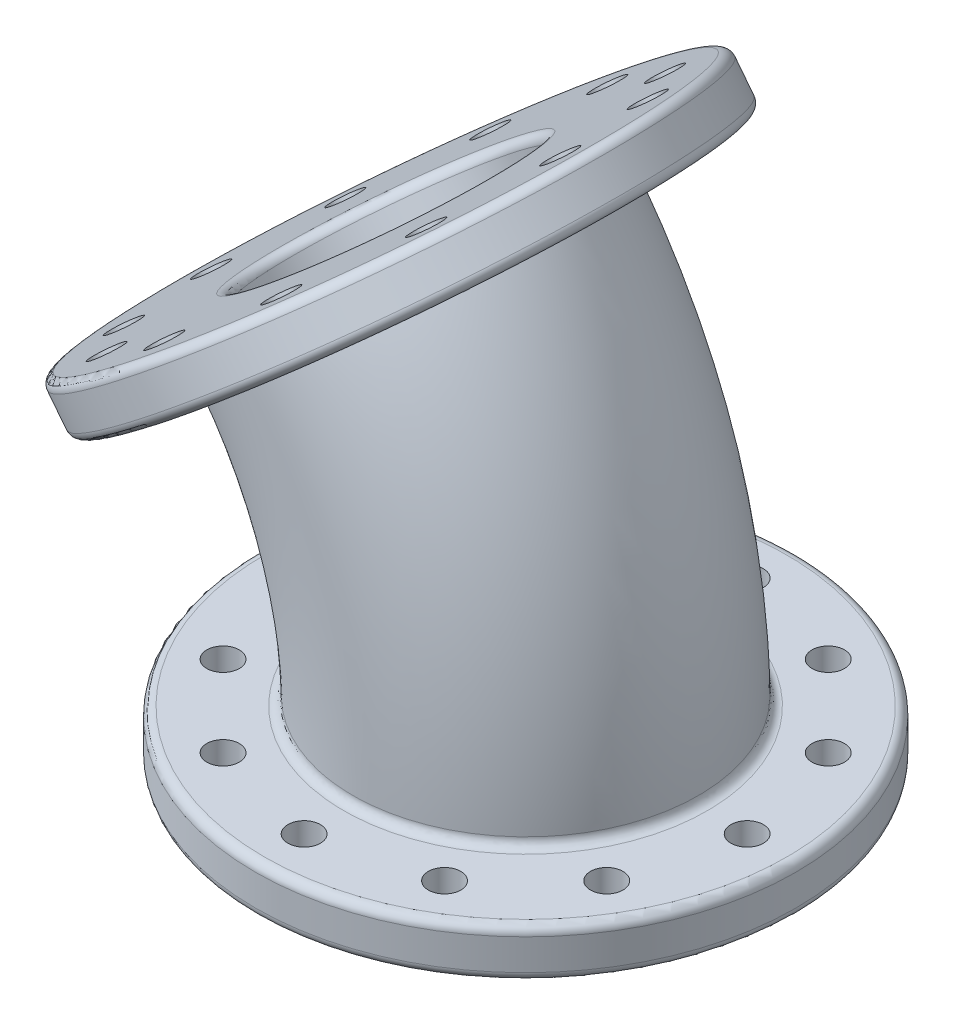
from build123d import *

# Parameters (mm, degrees)
SKETCH1_R           = 61
SKETCH1_R_2         = 3.665
SKETCH1_R_3         = 28
BOSS_EXTRUDE1_DEPTH = 11
SKETCH4_R           = 39
SKETCH4_R_2         = 28
REVOLVE3_ANGLE      = 38
FILLET2_R           = 2
SKETCH6_R           = 61
SKETCH6_R_2         = 28
SKETCH6_R_3         = 3.665
BOSS_EXTRUDE4_DEPTH = 11
FILLET3_R           = 2


with BuildPart() as part:
    # Sketch1 → Boss-Extrude1 (new body)
    with BuildSketch(Plane(origin=(0, 0, 0), x_dir=(1, 0, 0), z_dir=(0, 1, 0))):
        with Locations(Location((0, 0, 0), (0, 0, 270))):
            Circle(SKETCH1_R)
        with Locations(Location((0, 50, 0), (0, 0, 270))):
            Circle(SKETCH1_R_2, mode=Mode.SUBTRACT)
        with Locations(Location((0, 0, 0), (0, 0, 270))):
            Circle(SKETCH1_R_3, mode=Mode.SUBTRACT)
        with Locations(Location((25, 43.301270189, 0), (0, 0, 270))):
            Circle(SKETCH1_R_2, mode=Mode.SUBTRACT)
        with Locations(Location((43.301270189, 25, 0), (0, 0, 270))):
            Circle(SKETCH1_R_2, mode=Mode.SUBTRACT)
        with Locations(Location((50, 0, 0), (0, 0, 270))):
            Circle(SKETCH1_R_2, mode=Mode.SUBTRACT)
        with Locations(Location((43.301270189, -25, 0), (0, 0, 270))):
            Circle(SKETCH1_R_2, mode=Mode.SUBTRACT)
        with Locations(Location((25, -43.301270189, 0), (0, 0, 270))):
            Circle(SKETCH1_R_2, mode=Mode.SUBTRACT)
        with Locations(Location((0, -50, 0), (0, 0, 270))):
            Circle(SKETCH1_R_2, mode=Mode.SUBTRACT)
        with Locations(Location((-25, -43.301270189, 0), (0, 0, 270))):
            Circle(SKETCH1_R_2, mode=Mode.SUBTRACT)
        with Locations(Location((-43.301270189, -25, 0), (0, 0, 270))):
            Circle(SKETCH1_R_2, mode=Mode.SUBTRACT)
        with Locations(Location((-50, 0, 0), (0, 0, 270))):
            Circle(SKETCH1_R_2, mode=Mode.SUBTRACT)
        with Locations(Location((-43.301270189, 25, 0), (0, 0, 270))):
            Circle(SKETCH1_R_2, mode=Mode.SUBTRACT)
        with Locations(Location((-25, 43.301270189, 0), (0, 0, 270))):
            Circle(SKETCH1_R_2, mode=Mode.SUBTRACT)
    extrude(amount=BOSS_EXTRUDE1_DEPTH)

    # Sketch4 → Revolve3 (revolve)
    with BuildSketch(Plane(origin=(0, 11, 0), x_dir=(1, 0, 0), z_dir=(0, 1, 0))):
        Circle(SKETCH4_R)
        Circle(SKETCH4_R_2, mode=Mode.SUBTRACT)
    revolve(axis=Axis((-117, 11, 990.694114277), (0, 0, 1)), revolution_arc=REVOLVE3_ANGLE)

    # Fillet2
    fillet2_edges = [part.edges().sort_by_distance(p)[0] for p in [
        (0, 0, -61),
        (0, 11, -61),
        (-39, 11, 0),
        (0, 0, -28),
    ]]
    fillet(fillet2_edges, radius=FILLET2_R)

    # Sketch6 → Boss-Extrude4 (add)
    with BuildSketch(Plane(origin=(-49.684195602, 63.592870413, 0), x_dir=(0.7880107536067209, 0.6156614753256596, 0), z_dir=(-0.6156614753256596, 0.7880107536067209, 0))):
        with Locations(Location((31.575018057, 0, 0), (0, 0, 180))):
            Circle(SKETCH6_R)
        with Locations((31.575018057, 0)):
            Circle(SKETCH6_R_2, mode=Mode.SUBTRACT)
        with Locations(Location((31.575018057, 50, 0), (0, 0, 180))):
            Circle(SKETCH6_R_3, mode=Mode.SUBTRACT)
        with Locations(Location((56.575018057, 43.301270189, 0), (0, 0, 180))):
            Circle(SKETCH6_R_3, mode=Mode.SUBTRACT)
        with Locations(Location((74.876288246, 25, 0), (0, 0, 180))):
            Circle(SKETCH6_R_3, mode=Mode.SUBTRACT)
        with Locations(Location((81.575018057, 0, 0), (0, 0, 180))):
            Circle(SKETCH6_R_3, mode=Mode.SUBTRACT)
        with Locations(Location((74.876288246, -25, 0), (0, 0, 180))):
            Circle(SKETCH6_R_3, mode=Mode.SUBTRACT)
        with Locations(Location((56.575018057, -43.301270189, 0), (0, 0, 180))):
            Circle(SKETCH6_R_3, mode=Mode.SUBTRACT)
        with Locations(Location((31.575018057, -50, 0), (0, 0, 180))):
            Circle(SKETCH6_R_3, mode=Mode.SUBTRACT)
        with Locations(Location((6.575018057, -43.301270189, 0), (0, 0, 180))):
            Circle(SKETCH6_R_3, mode=Mode.SUBTRACT)
        with Locations(Location((-11.726252133, -25, 0), (0, 0, 180))):
            Circle(SKETCH6_R_3, mode=Mode.SUBTRACT)
        with Locations(Location((-18.424981943, 0, 0), (0, 0, 180))):
            Circle(SKETCH6_R_3, mode=Mode.SUBTRACT)
        with Locations(Location((-11.726252133, 25, 0), (0, 0, 180))):
            Circle(SKETCH6_R_3, mode=Mode.SUBTRACT)
        with Locations(Location((6.575018057, 43.301270189, 0), (0, 0, 180))):
            Circle(SKETCH6_R_3, mode=Mode.SUBTRACT)
    extrude(amount=BOSS_EXTRUDE4_DEPTH)

    # Fillet3
    fillet3_edges = [part.edges().sort_by_distance(p)[0] for p in [
        (-55.535161219, 59.021595075, 0),
        (16.493637913, 129.255860898, 0),
        (23.265914142, 120.587742608, 0),
        (-53.639319158, 74.461989594, 0),
    ]]
    fillet(fillet3_edges, radius=FILLET3_R)


solid = part.part
